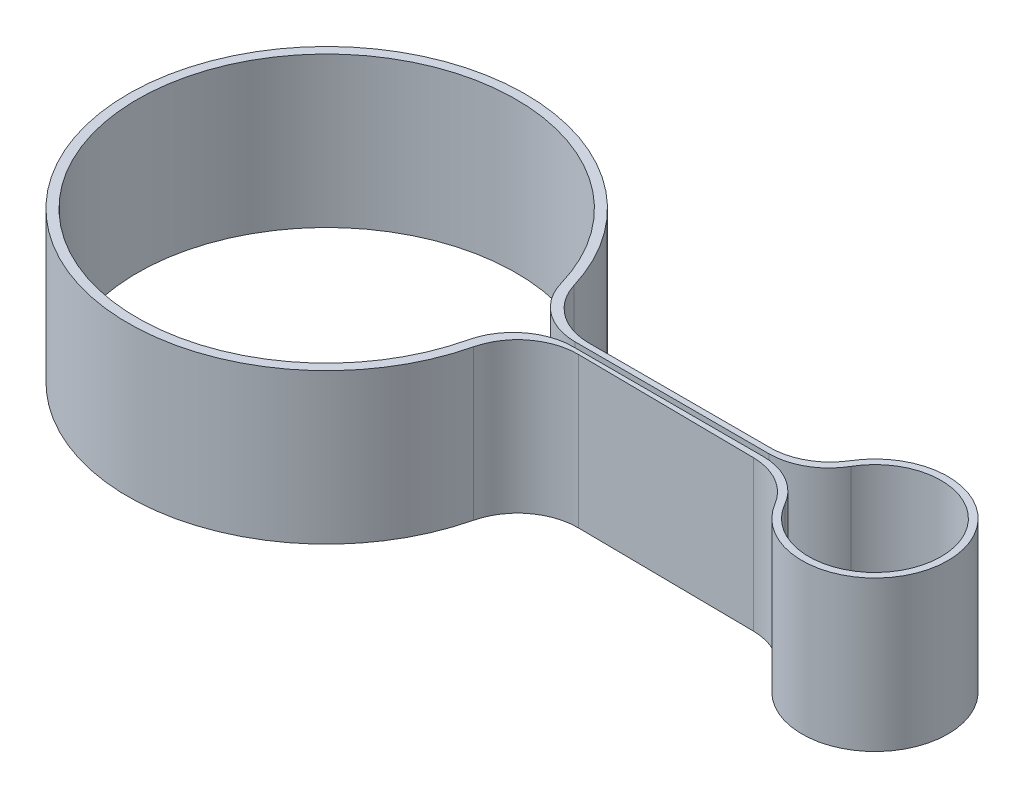
from build123d import *

# Parameters (mm, degrees)
EXTRUDE_1_DEPTH = 25
FILLET_1_R      = 10
FILLET_2_R      = 10
FILLET_3_R      = 10
FILLET_4_R      = 10


with BuildPart() as part:
    # Эскиз1 → Вытянуть1 (new body)
    with BuildSketch(Plane(origin=(0, 0, 0), x_dir=(1, 0, 0), z_dir=(0, 1, 0))):
        with BuildLine():
            Line((67.101671661, -51.500497432), (112.378503317, -51.500497432))
            ThreePointArc((112.378503317, -51.500497432), (136.559037069, -53.030762447), (112.368799134, -54.399087045))
            Line((112.368799134, -54.399087045), (67.191980368, -53.918527595))
            ThreePointArc((67.191980368, -53.918527595), (1.146798105, -55.174484728), (67.101671661, -51.500497432))
        make_face()
        with BuildLine():
            Line((65.623717724, -52.474815373), (113.434997223, -52.474815373))
            ThreePointArc((113.434997223, -52.474815373), (135.422626362, -53.070517379), (113.428639384, -53.344803486))
            Line((113.428639384, -53.344803486), (65.65222177, -53.344262878))
            ThreePointArc((65.65222177, -53.344262878), (2.674800085, -54.973729362), (65.623717724, -52.474815373))
        make_face(mode=Mode.SUBTRACT)
    extrude(amount=EXTRUDE_1_DEPTH)

    # Скругление1
    fillet_1_edges = [part.edges().sort_by_distance(p)[0] for p in [
        (67.191980368, 12.5, 53.918527595),
    ]]
    fillet(fillet_1_edges, radius=FILLET_1_R)

    # Скругление2
    fillet_2_edges = [part.edges().sort_by_distance(p)[0] for p in [
        (65.65222177, 12.5, 53.344262878),
    ]]
    fillet(fillet_2_edges, radius=FILLET_2_R)

    # Скругление3
    fillet_3_edges = [part.edges().sort_by_distance(p)[0] for p in [
        (65.623717724, 12.5, 52.474815373),
        (67.101671661, 12.5, 51.500497432),
    ]]
    fillet(fillet_3_edges, radius=FILLET_3_R)

    # Скругление4
    fillet_4_edges = [part.edges().sort_by_distance(p)[0] for p in [
        (113.428639384, 12.5, 53.344803486),
        (113.434997223, 12.5, 52.474815373),
        (112.378503317, 12.5, 51.500497432),
        (112.368799134, 12.5, 54.399087045),
    ]]
    fillet(fillet_4_edges, radius=FILLET_4_R)


solid = part.part
